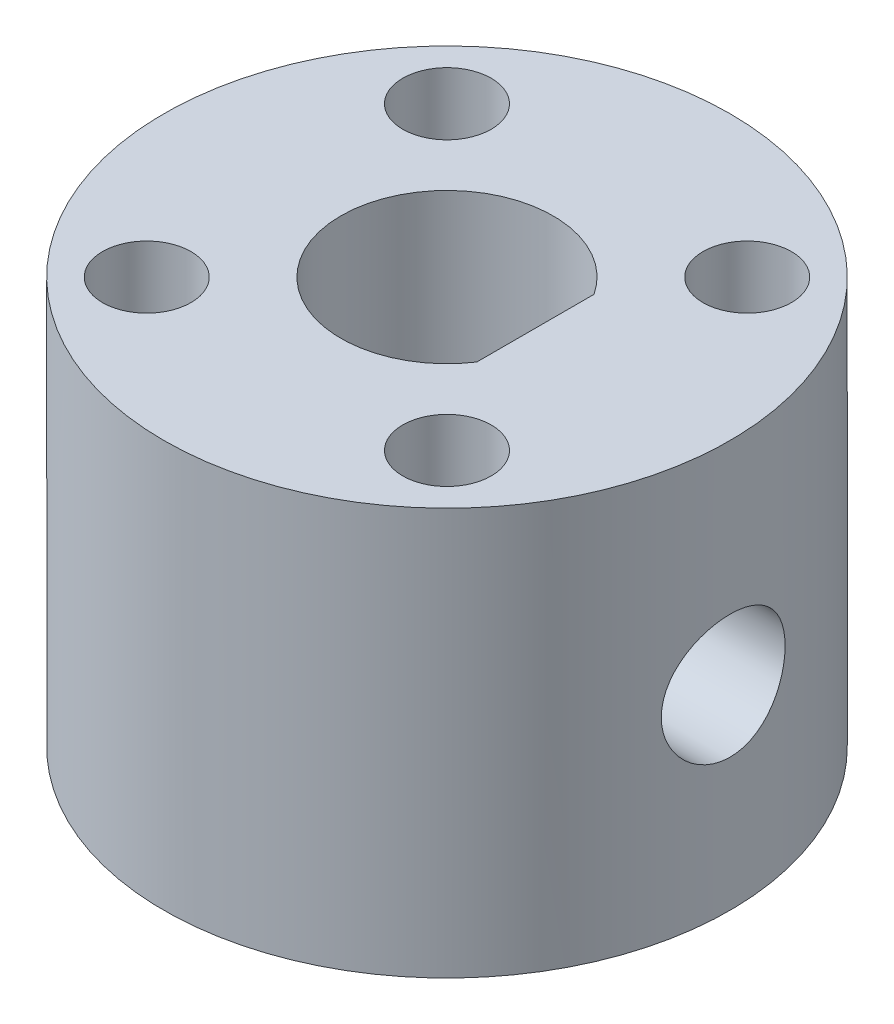
from build123d import *

# Parameters (mm, degrees)
SKETCH_1_R          = 8
SKETCH_1_R_2        = 1.25
EXTRUDE_1_DEPTH     = 12.5
SKETCH_3_R          = 1.75
CUT_EXTRUDE_1_DEPTH = 10
SKETCH_5_R          = 11.085638204
CUT_EXTRUDE_2_DEPTH = 1


with BuildPart() as part:
    # 草图1 → 凸台-拉伸1 (new body)
    with BuildSketch(Plane(origin=(0, 0, 0), x_dir=(1, 0, 0), z_dir=(0, 1, 0))):
        with Locations(Location((0, 0, 0), (0, 0, 270))):
            Circle(SKETCH_1_R)
        with Locations(Location((4.242640687, 4.242640687, 0), (0, 0, 270))):
            Circle(SKETCH_1_R_2, mode=Mode.SUBTRACT)
        with Locations(Location((4.242640687, -4.242640687, 0), (0, 0, 270))):
            Circle(SKETCH_1_R_2, mode=Mode.SUBTRACT)
        with Locations(Location((-4.242640687, -4.242640687, 0), (0, 0, 270))):
            Circle(SKETCH_1_R_2, mode=Mode.SUBTRACT)
        with Locations(Location((-4.242640687, 4.242640687, 0), (0, 0, 270))):
            Circle(SKETCH_1_R_2, mode=Mode.SUBTRACT)
        with BuildLine():
            Line((2.5, 1.658312395), (2.5, -1.658312395))
            ThreePointArc((2.5, -1.658312395), (-3, 0), (2.5, 1.658312395))
        make_face(mode=Mode.SUBTRACT)
    extrude(amount=EXTRUDE_1_DEPTH)

    # 草图3 → 切除-拉伸1 (cut)
    with BuildSketch(Plane.ZY.offset(-2.5)):
        with Locations((0, 6.5)):
            Circle(SKETCH_3_R)
    extrude(amount=-CUT_EXTRUDE_1_DEPTH, mode=Mode.SUBTRACT)

    # 草图5 → 切除-拉伸2 (cut)
    with BuildSketch(Plane.XZ):
        Circle(SKETCH_5_R)
    extrude(amount=-CUT_EXTRUDE_2_DEPTH, mode=Mode.SUBTRACT)


solid = part.part
